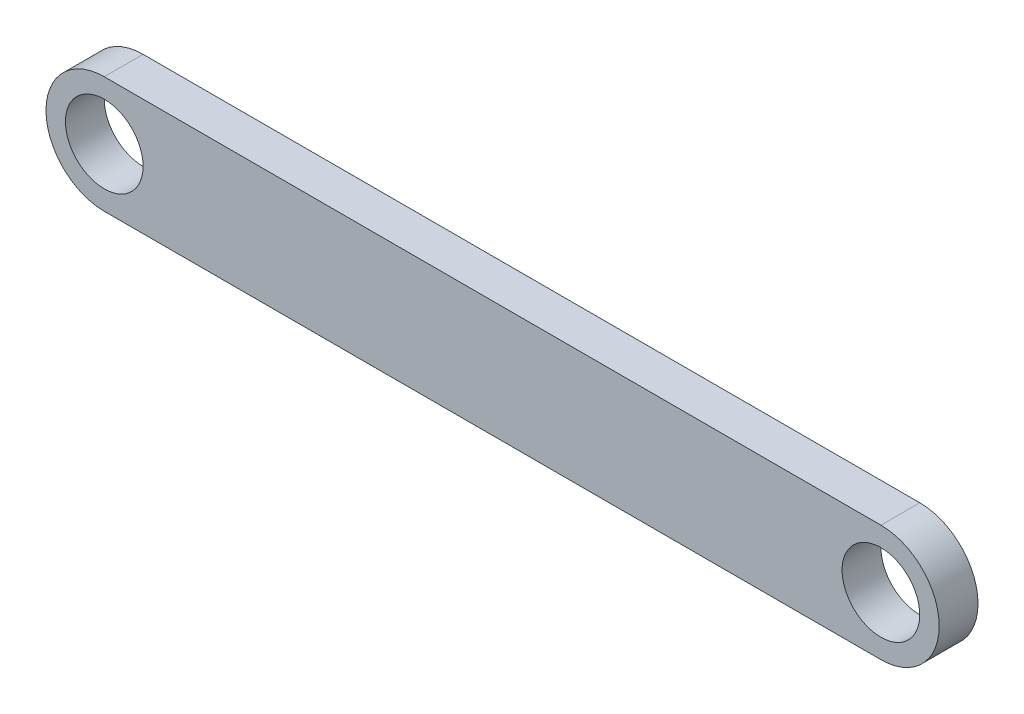
from build123d import *

# Parameters (mm, degrees)
SKETCH1_R           = 10
BOSS_EXTRUDE1_DEPTH = 5


with BuildPart() as part:
    # Sketch1 → Boss-Extrude1 (new, symmetric)
    with BuildSketch(Plane.XY):
        with BuildLine():
            Line((0, -15), (-200, -15))
            ThreePointArc((-200, -15), (-215, 0), (-200, 15))
            Line((-200, 15), (0, 15))
            ThreePointArc((0, 15), (15, 0), (0, -15))
        make_face()
        with Locations((-200, 0)):
            Circle(SKETCH1_R, mode=Mode.SUBTRACT)
        Circle(SKETCH1_R, mode=Mode.SUBTRACT)
    extrude(amount=BOSS_EXTRUDE1_DEPTH, both=True)


solid = part.part
